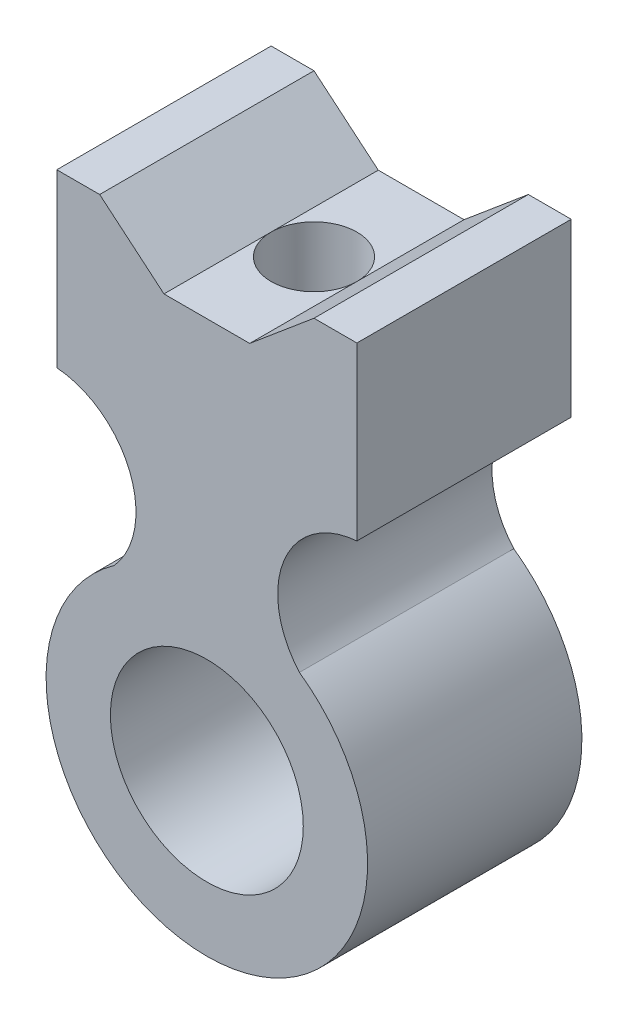
from build123d import *

# Parameters (mm, degrees)
SKETCH1_R               = 22.5
BOSS_EXTRUDE1_DEPTH     = 50
CUT_EXTRUDE1_REACH      = 145.178
CUT_EXTRUDE1_END_RADIUS = 22.5
SKETCH3_R               = 10


with BuildPart() as part:
    # Sketch1 → Boss-Extrude1 (new body)
    with BuildSketch(Plane.XY):
        with BuildLine():
            Line((-25, 103.903355596), (-10, 91.316861128))
            Line((-10, 91.316861128), (10, 91.316861128))
            Line((10, 91.316861128), (25, 103.903355596))
            Line((25, 103.903355596), (35, 103.903355596))
            Line((35, 103.903355596), (35, 63.903355596))
            ThreePointArc((35, 63.903355596), (17.980602011, 51.434096177), (21.606705181, 30.649637701))
            ThreePointArc((21.606705181, 30.649637701), (0, -37.5), (-21.606705181, 30.649637701))
            ThreePointArc((-21.606705181, 30.649637701), (-17.980602011, 51.434096177), (-35, 63.903355596))
            Line((-35, 63.903355596), (-35, 103.903355596))
            Line((-35, 103.903355596), (-25, 103.903355596))
        make_face()
        Circle(SKETCH1_R, mode=Mode.SUBTRACT)
    extrude(amount=BOSS_EXTRUDE1_DEPTH)

    # Cut-Extrude1: up to this cylinder (the profile starts outside it)
    cut_extrude1_end = Plane(origin=(0, 0, 25), z_dir=(0, 0, -1)) * Cylinder(CUT_EXTRUDE1_END_RADIUS, 336.356, mode=Mode.PRIVATE)
    # Sketch3 → Cut-Extrude1 (cut, up to the surface)
    with BuildSketch(Plane(origin=(0, 91.316861128, 0), x_dir=(1, 0, 0), z_dir=(0, 1, 0)), mode=Mode.PRIVATE) as cut_extrude1_sk1:
        with Locations(Location((0, -25, 0), (0, 0, 270))):
            Circle(SKETCH3_R)
    cut_extrude1_tool1 = extrude(cut_extrude1_sk1.sketch, amount=-CUT_EXTRUDE1_REACH, mode=Mode.PRIVATE) - cut_extrude1_end
    add(cut_extrude1_tool1.solids().sort_by_distance((0, 91.316861, 25))[0], mode=Mode.SUBTRACT)


solid = part.part
